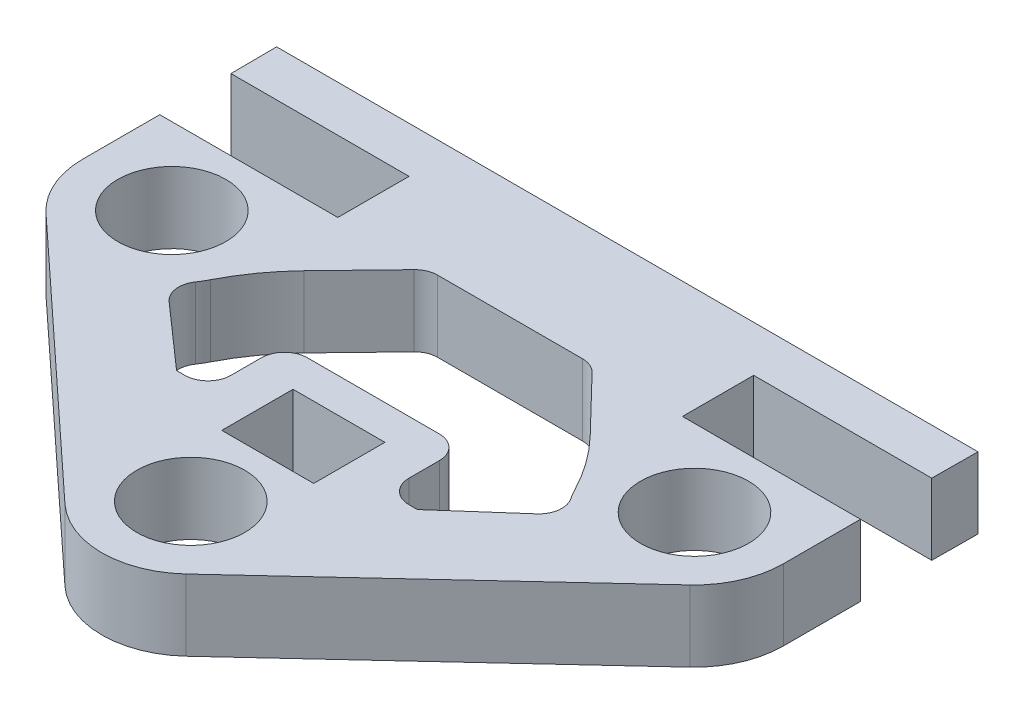
from build123d import *

# Parameters (mm, degrees)
SKETCH1_R      = 2.35
SKETCH1_W      = 4
SKETCH1_H      = 3.1
EXTRUDE1_DEPTH = 3.1


with BuildPart() as part:
    # Sketch1 → Extrude1 (new body)
    with BuildSketch(Plane(origin=(0, 0, 0), x_dir=(1, 0, 0), z_dir=(0, 1, 0))):
        with BuildLine():
            Line((-41.013157114, 29.408489293), (-41.013157114, 26.058489293))
            ThreePointArc((-41.013157114, 26.058489293), (-40.689672648, 24.508533678), (-39.773228128, 23.217358224))
            Line((-39.773228128, 23.217358224), (-28.398228128, 12.667358224))
            ThreePointArc((-28.398228128, 12.667358224), (-25.763157114, 11.633489293), (-23.1280861, 12.667358224))
            Line((-23.1280861, 12.667358224), (-11.7530861, 23.217358224))
            ThreePointArc((-11.7530861, 23.217358224), (-10.83664158, 24.508533678), (-10.513157114, 26.058489293))
            Line((-10.513157114, 26.058489293), (-10.513157114, 29.408489293))
            Line((-10.513157114, 29.408489293), (-18.263157114, 29.408489293))
            Line((-18.263157114, 29.408489293), (-18.263157114, 32.508489293))
            Line((-18.263157114, 32.508489293), (-10.513157114, 32.508489293))
            Line((-10.513157114, 32.508489293), (-10.498924525, 34.508489293))
            Line((-10.498924525, 34.508489293), (-41.027382287, 34.508489293))
            Line((-41.027382287, 34.508489293), (-41.013157114, 32.508489293))
            Line((-41.013157114, 32.508489293), (-33.263157114, 32.508489293))
            Line((-33.263157114, 32.508489293), (-33.263157114, 29.408489293))
            Line((-33.263157114, 29.408489293), (-41.013157114, 29.408489293))
        make_face()
        with Locations(Location((-14.388157114, 26.058489293, 0), (0, 0, 90))):
            Circle(SKETCH1_R, mode=Mode.SUBTRACT)
        with Locations(Location((-37.138157114, 26.058489293, 0), (0, 0, 90))):
            Circle(SKETCH1_R, mode=Mode.SUBTRACT)
        with Locations(Location((-25.763157114, 15.508489293, 0), (0, 0, 90))):
            Circle(SKETCH1_R, mode=Mode.SUBTRACT)
        with BuildLine():
            Line((-33.76750302, 22.568552775), (-31.002944054, 20.130132194))
            Line((-31.002944054, 20.130132194), (-30.638157114, 20.130132194))
            ThreePointArc((-30.638157114, 20.130132194), (-29.931050333, 20.423025412), (-29.638157114, 21.130132194))
            Line((-29.638157114, 21.130132194), (-29.638157114, 22.458489293))
            ThreePointArc((-29.638157114, 22.458489293), (-29.345263895, 23.165596075), (-28.638157114, 23.458489293))
            Line((-28.638157114, 23.458489293), (-22.889213944, 23.458489293))
            ThreePointArc((-22.889213944, 23.458489293), (-22.182388419, 23.165877219), (-21.889214261, 22.459284647))
            Line((-21.889214261, 22.459284647), (-21.888157114, 21.130132194))
            ThreePointArc((-21.888157114, 21.130132194), (-21.595263895, 20.423025412), (-20.888157114, 20.130132194))
            Line((-20.888157114, 20.130132194), (-20.523370174, 20.130132194))
            Line((-20.523370174, 20.130132194), (-17.758811208, 22.568552775))
            ThreePointArc((-17.758811208, 22.568552775), (-17.428169762, 23.19327051), (-17.593190704, 23.880558008))
            ThreePointArc((-17.593190704, 23.880558008), (-17.720651816, 24.081090988), (-17.835582513, 24.289059126))
            ThreePointArc((-17.835582513, 24.289059126), (-18.600140603, 25.542598068), (-19.540017718, 26.670667198))
            Line((-19.540017718, 26.670667198), (-21.890008982, 29.103277241))
            ThreePointArc((-21.890008982, 29.103277241), (-22.218575416, 29.329029338), (-22.609223629, 29.408489293))
            Line((-22.609223629, 29.408489293), (-28.917090599, 29.408489293))
            ThreePointArc((-28.917090599, 29.408489293), (-29.307738812, 29.329029338), (-29.636305246, 29.103277241))
            Line((-29.636305246, 29.103277241), (-31.98629651, 26.670667198))
            ThreePointArc((-31.98629651, 26.670667198), (-32.926173625, 25.542598068), (-33.690731715, 24.289059126))
            ThreePointArc((-33.690731715, 24.289059126), (-33.805662411, 24.081090988), (-33.933123524, 23.880558008))
            ThreePointArc((-33.933123524, 23.880558008), (-34.098144466, 23.19327051), (-33.76750302, 22.568552775))
        make_face(mode=Mode.SUBTRACT)
        with Locations((-25.763157114, 20.408489293)):
            Rectangle(SKETCH1_W, SKETCH1_H, mode=Mode.SUBTRACT)
    extrude(amount=EXTRUDE1_DEPTH)


solid = part.part
